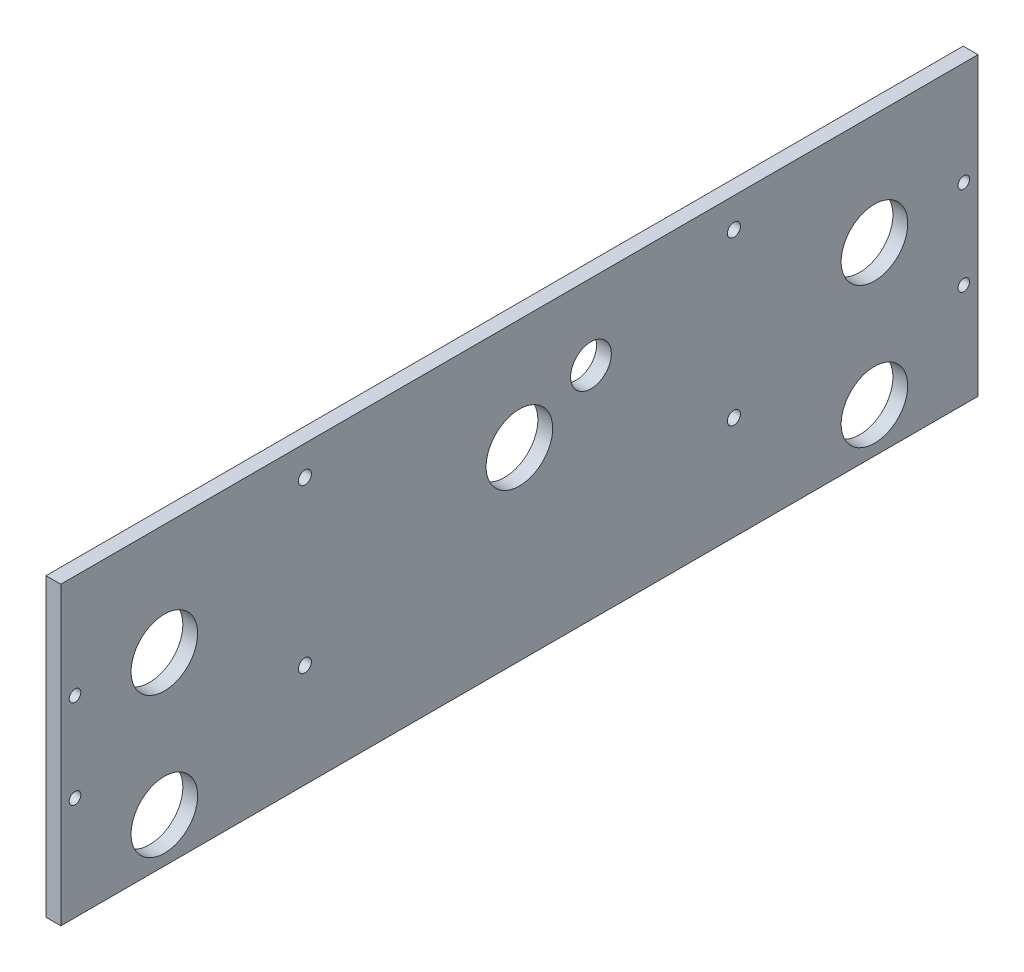
from build123d import *

# Parameters (mm, degrees)
SKETCH1_W                                       = 393.7
SKETCH1_H                                       = 127
BOSS_EXTRUDE1_DEPTH                             = 6.35
SKETCH2_R                                       = 14.2875
SKETCH2_R_2                                     = 8.750046
CUT_EXTRUDE1_DEPTH                              = 207.935968357
F_10_CLEARANCE_HOLE1_D                          = 4.9784
CSK_FOR_10_FLAT_HEAD_MACHINE_SCREW2_D           = 5.6134
CSK_FOR_10_FLAT_HEAD_MACHINE_SCREW2_CSINK_D     = 9.779
CSK_FOR_10_FLAT_HEAD_MACHINE_SCREW2_CSINK_ANGLE = 82


with BuildPart() as part:
    # Sketch1 → Boss-Extrude1 (new body)
    with BuildSketch(Plane(origin=(0, 0, 0), x_dir=(0, 0, -1), z_dir=(1, 0, 0))):
        Rectangle(SKETCH1_W, SKETCH1_H)
    extrude(amount=BOSS_EXTRUDE1_DEPTH)

    # Sketch2 → Cut-Extrude1 (cut, through all)
    with BuildSketch(Plane(origin=(6.35, 0, 0), x_dir=(0, 0, -1), z_dir=(1, 0, 0))):
        with Locations((0, 15.875)):
            Circle(SKETCH2_R)
        with Locations((-152.4, 15.875)):
            Circle(SKETCH2_R)
        with Locations((152.4, 15.875)):
            Circle(SKETCH2_R)
        with Locations((-152.4, -44.45)):
            Circle(SKETCH2_R)
        with Locations((152.4, -44.45)):
            Circle(SKETCH2_R)
        with Locations((30.717202021, 31.115)):
            Circle(SKETCH2_R_2)
    extrude(amount=-CUT_EXTRUDE1_DEPTH, mode=Mode.SUBTRACT)

    # #10 Clearance Hole1 (through all)
    with Locations(Plane(origin=(6.35, 0, 0), x_dir=(0, 0, -1), z_dir=(1, 0, 0))):
        with Locations((-190.754, 19.05), (-190.754, -19.05), (190.754, 19.05), (190.754, -19.05)):
            Hole(F_10_CLEARANCE_HOLE1_D / 2)

    # CSK for #10 Flat Head Machine Screw2 (through all)
    with Locations(Plane.ZY):
        with Locations((-92.075, 50.8), (-92.075, -19.05), (92.075, -19.05), (92.075, 50.8)):
            CounterSinkHole(CSK_FOR_10_FLAT_HEAD_MACHINE_SCREW2_D / 2, CSK_FOR_10_FLAT_HEAD_MACHINE_SCREW2_CSINK_D / 2, counter_sink_angle=CSK_FOR_10_FLAT_HEAD_MACHINE_SCREW2_CSINK_ANGLE)


solid = part.part
